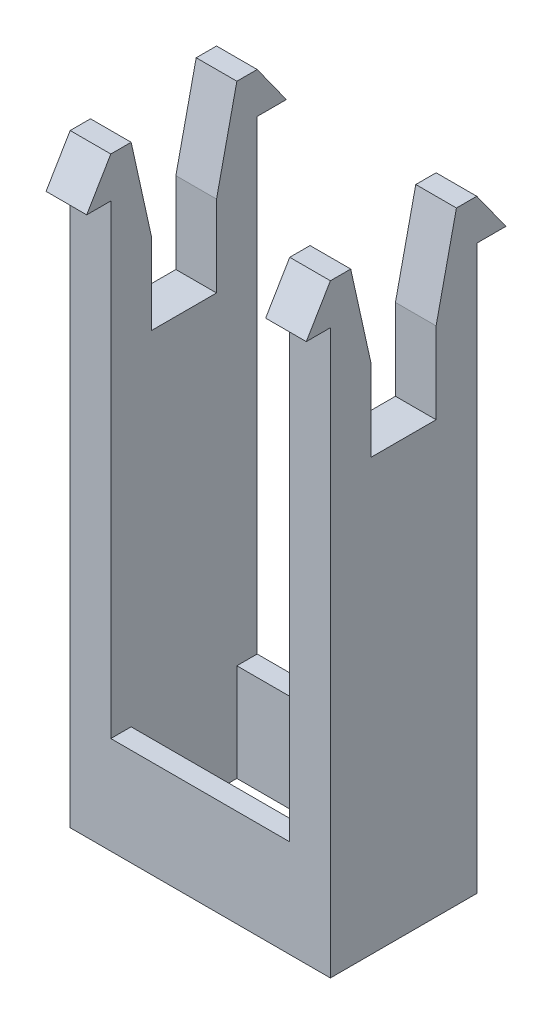
from build123d import *

# Parameters (mm, degrees)
SKETCH1_W               = 9
SKETCH1_H               = 31.450000092
BOSS_EXTRUDE1_DEPTH     = 16
CUT_EXTRUDE1_DEPTH      = 35.82109913
CUT_EXTRUDE1_DEPTH_BACK = 35.82109913
SKETCH2_W               = 11
SKETCH2_H               = 31.125000096
CUT_EXTRUDE2_DEPTH      = 36.673425061
CUT_EXTRUDE2_DEPTH_BACK = 36.673425061
SKETCH3_W               = 4
SKETCH3_H               = 5
SKETCH4_W               = 11
SKETCH4_H               = 6.5
CUT_EXTRUDE3_DEPTH      = 38.434719306


with BuildPart() as part:
    # Sketch1 → Boss-Extrude1 (new body)
    with BuildSketch(Plane(origin=(0, 0, 0), x_dir=(0, 0, -1), z_dir=(1, 0, 0))):
        Polygon((-1.013717106, 26.482765172), (-2.807616659, 28.982765172), (-2.807616659, 26.482765172), align=None)
        Polygon((-2.807616659, 26.482765172), (-2.807616659, 28.982765172), (-4.057616659, 28.982765172), (-5.307616659, 23.332810224), (-5.307616659, 23.307765168), (-2.807616659, 23.307765168), align=None)
        Polygon((-11.807616659, 23.307765168), (-9.307616659, 23.307765168), (-9.307616659, 23.332810224), (-10.557616659, 28.982765172), (-11.807616659, 28.982765172), (-11.807616659, 26.482765172), align=None)
        Polygon((-13.288814039, 26.482765172), (-11.807616659, 26.482765172), (-11.807616659, 28.982765172), align=None)
        with Locations((-7.307616659, 7.582765122)):
            Rectangle(SKETCH1_W, SKETCH1_H)
    extrude(amount=-BOSS_EXTRUDE1_DEPTH)

    # Sketch2 → Cut-Extrude1 (cut, two sides: drawn at the far end of the back side and taken through both)
    with BuildSketch(Plane.XY.offset(11.807616659).offset(-CUT_EXTRUDE1_DEPTH_BACK)):
        with Locations((-8, 13.420265124)):
            Rectangle(SKETCH2_W, SKETCH2_H)
    extrude(amount=CUT_EXTRUDE1_DEPTH + CUT_EXTRUDE1_DEPTH_BACK, mode=Mode.SUBTRACT)

    # Sketch3 → Cut-Extrude2 (cut, two sides: drawn at the far end of the back side and taken through both)
    with BuildSketch(Plane(origin=(0, 0, 0), x_dir=(0, 0, -1), z_dir=(1, 0, 0)).offset(-CUT_EXTRUDE2_DEPTH_BACK)):
        with Locations((-7.307616659, 20.832810224)):
            Rectangle(SKETCH3_W, SKETCH3_H)
    extrude(amount=CUT_EXTRUDE2_DEPTH + CUT_EXTRUDE2_DEPTH_BACK, mode=Mode.SUBTRACT)

    # Sketch4 → Cut-Extrude3 (cut, through all)
    with BuildSketch(Plane(origin=(0, -2.142234924, 0), x_dir=(1, 0, 0), z_dir=(0, 1, 0))):
        with Locations((-8, -7.307616659)):
            Rectangle(SKETCH4_W, SKETCH4_H)
    extrude(amount=-CUT_EXTRUDE3_DEPTH, mode=Mode.SUBTRACT)


solid = part.part
